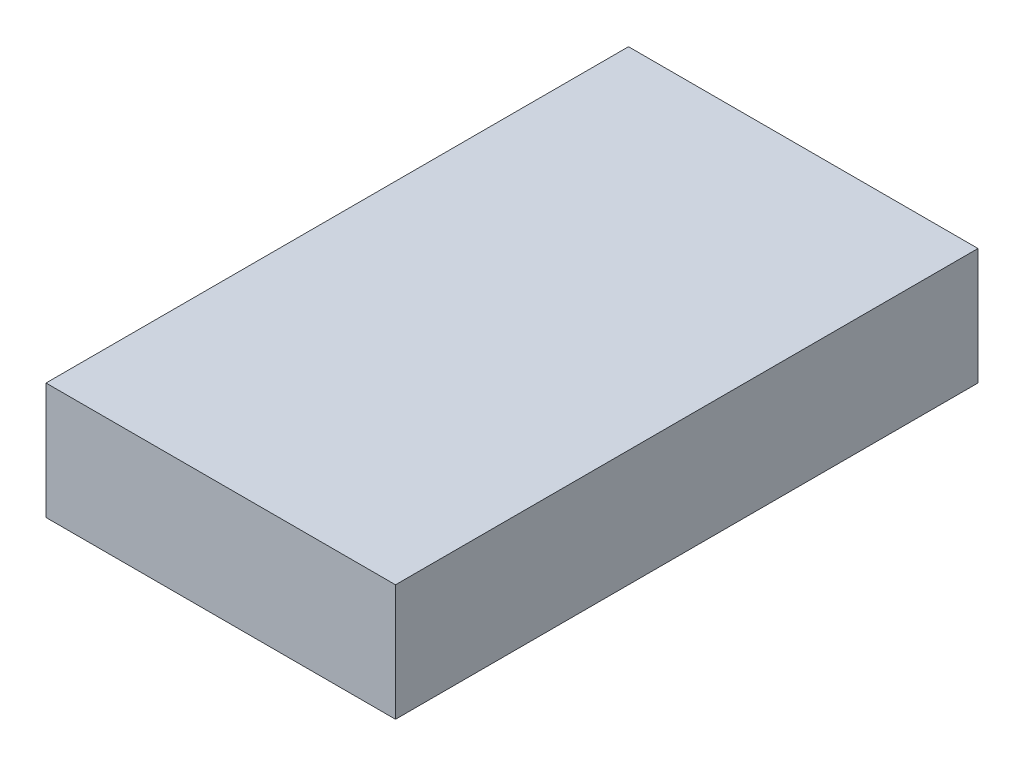
from build123d import *

# Parameters (mm, degrees)
SKETCH_1_W      = 180
SKETCH_1_H      = 60
EXTRUDE_1_DEPTH = 300


with BuildPart() as part:
    # 草图1 → 凸台-拉伸1 (new body)
    with BuildSketch(Plane.XY):
        with Locations((-3.652173913, 70.434782609)):
            Rectangle(SKETCH_1_W, SKETCH_1_H)
    extrude(amount=EXTRUDE_1_DEPTH)


solid = part.part
